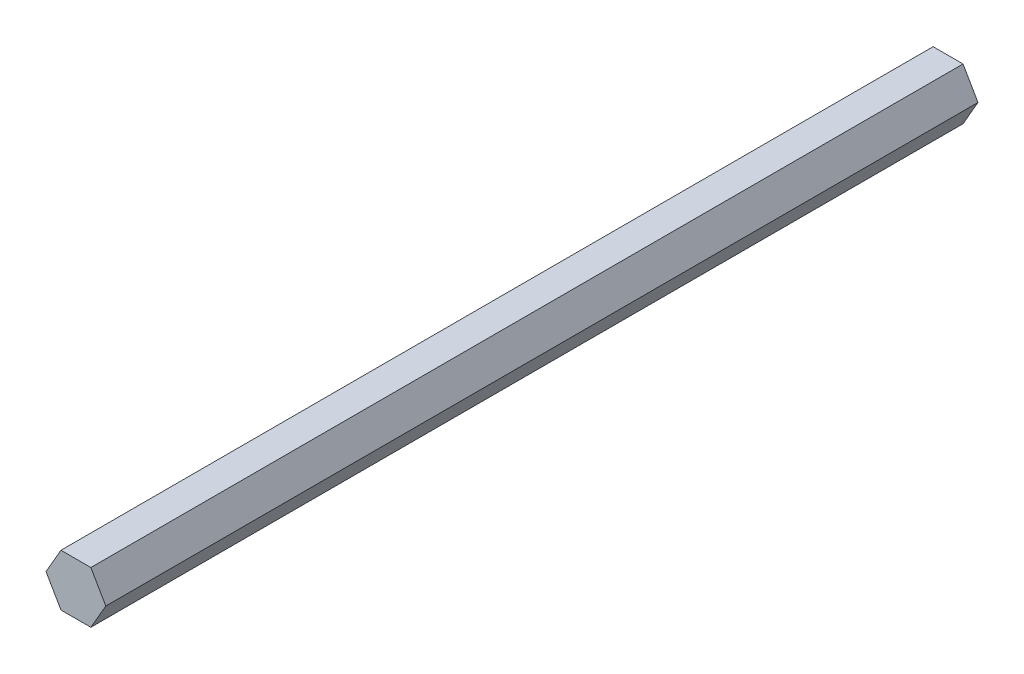
from build123d import *

# Parameters (mm, degrees)
BOSS_EXTRUDE1_DEPTH = 87.5


with BuildPart() as part:
    # Sketch1 → Boss-Extrude1 (new body)
    with BuildSketch(Plane.XY):
        Polygon((3, 0), (1.5, 2.598076211), (-1.5, 2.598076211), (-3, 0), (-1.5, -2.598076211), (1.5, -2.598076211), align=None)
    extrude(amount=BOSS_EXTRUDE1_DEPTH)


solid = part.part
